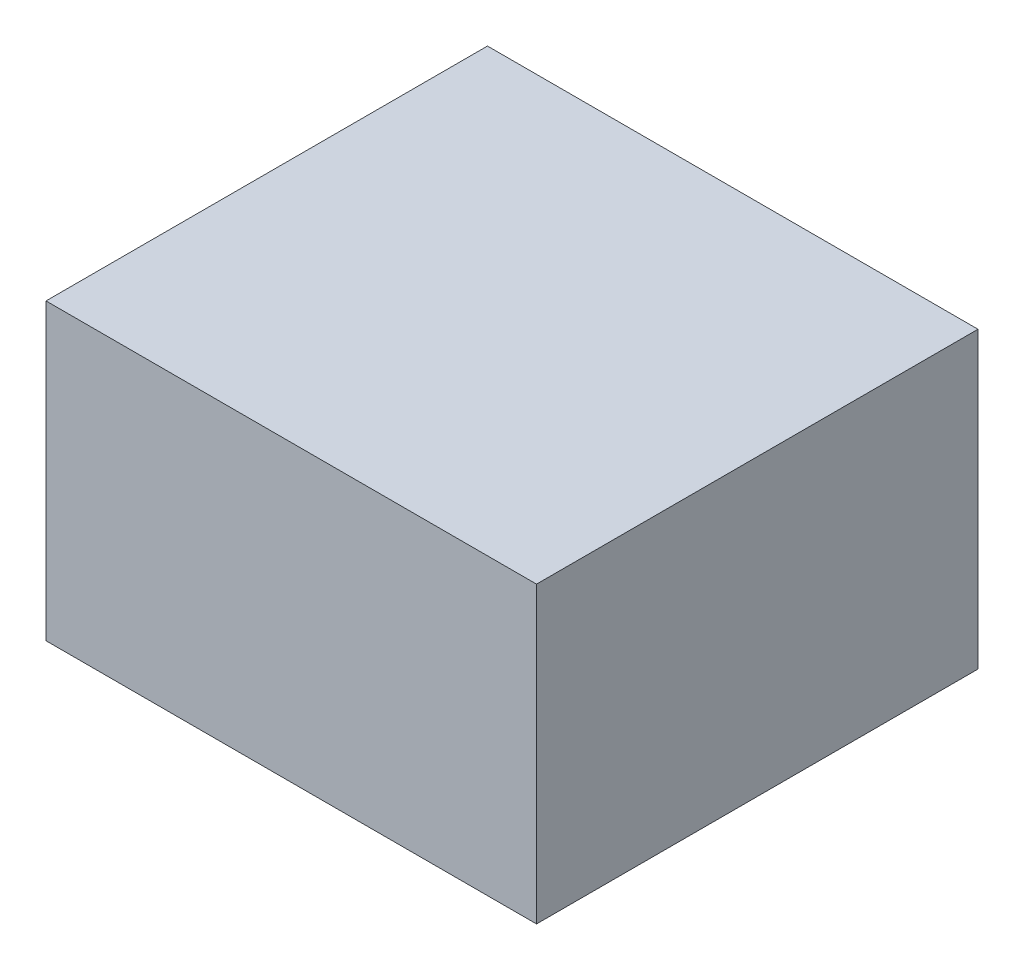
from build123d import *

# Parameters (mm, degrees)
SKETCH1_W           = 100
SKETCH1_H           = 60
BOSS_EXTRUDE1_DEPTH = 90


with BuildPart() as part:
    # Sketch1 → Boss-Extrude1 (new body)
    with BuildSketch(Plane.XY):
        with Locations((50, 30)):
            Rectangle(SKETCH1_W, SKETCH1_H)
    extrude(amount=BOSS_EXTRUDE1_DEPTH)


solid = part.part
